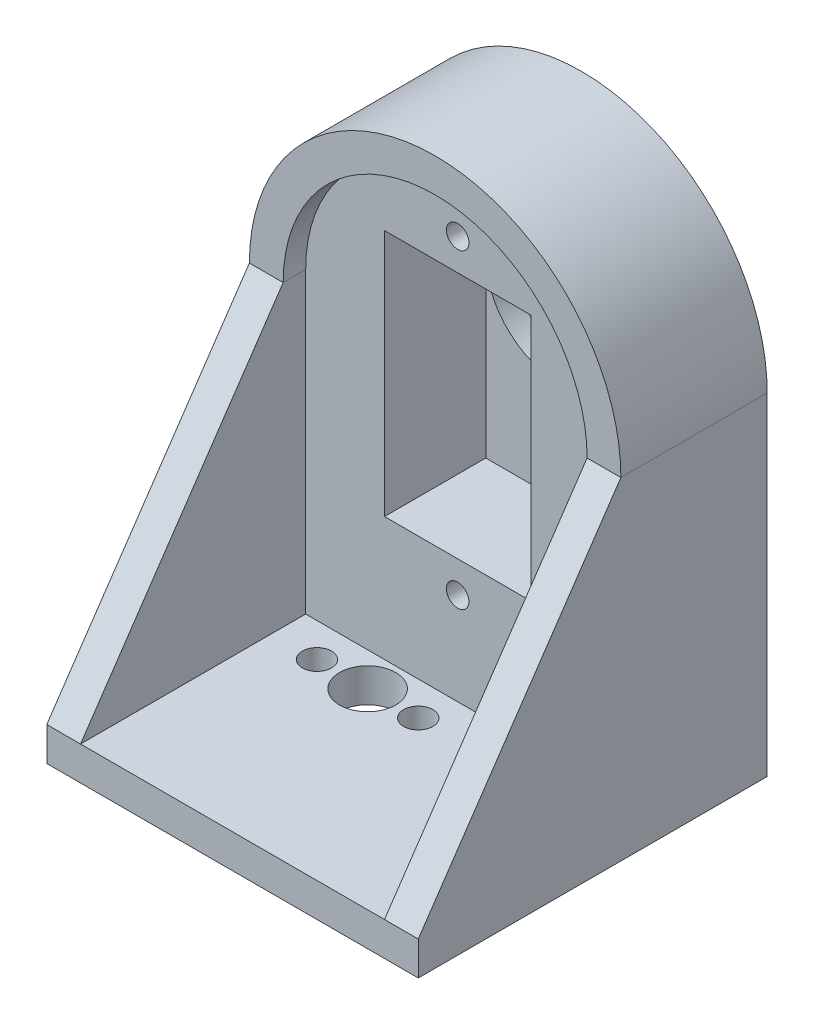
from build123d import *

# Parameters (mm, degrees)
SKETCH1_R           = 6.5
BOSS_EXTRUDE1_DEPTH = 13
CUT_EXTRUDE1_DEPTH  = 2
SKETCH3_R           = 1
SKETCH3_W           = 13
SKETCH3_H           = 22
CUT_EXTRUDE2_DEPTH  = 9
BOSS_EXTRUDE2_DEPTH = 18
BOSS_EXTRUDE3_DEPTH = 1.5
BOSS_EXTRUDE4_DEPTH = 1.5
SKETCH7_R           = 2.5
SKETCH7_R_2         = 1.3
CUT_EXTRUDE3_DEPTH  = 5


with BuildPart() as part:
    # Sketch1 → Boss-Extrude1 (new body)
    with BuildSketch(Plane.XY):
        with BuildLine():
            Line((-16.5, 0), (-16.5, -29.5))
            Line((-16.5, -29.5), (16.5, -29.5))
            Line((16.5, -29.5), (16.5, 0))
            ThreePointArc((16.5, 0), (0, 16.5), (-16.5, 0))
        make_face()
        with Locations(Location((0, 0, 0), (0, 0, 180))):
            Circle(SKETCH1_R, mode=Mode.SUBTRACT)
    extrude(amount=BOSS_EXTRUDE1_DEPTH)

    # Sketch2 → Cut-Extrude1 (cut)
    with BuildSketch(Plane.XY.offset(13)):
        with BuildLine():
            Line((-13.5, -26.5), (13.5, -26.5))
            Line((13.5, -26.5), (13.5, 0))
            ThreePointArc((13.5, 0), (0, 13.5), (-13.5, 0))
            Line((-13.5, 0), (-13.5, -26.5))
        make_face()
    extrude(amount=-CUT_EXTRUDE1_DEPTH, mode=Mode.SUBTRACT)

    # Sketch3 → Cut-Extrude2 (cut)
    with BuildSketch(Plane.XY.offset(11)):
        with Locations((0, 9.3)):
            Circle(SKETCH3_R)
        with Locations(Location((0, -18.3, 0), (0, 0, 180))):
            Circle(SKETCH3_R)
        with Locations((0, -4.5)):
            Rectangle(SKETCH3_W, SKETCH3_H)
    extrude(amount=-CUT_EXTRUDE2_DEPTH, mode=Mode.SUBTRACT)

    # Sketch4 → Boss-Extrude2 (add)
    with BuildSketch(Plane.XY.offset(13)):
        Polygon((-16.5, -26.5), (-16.5, -29.5), (16.5, -29.5), (16.5, -26.5), (13.5, -26.5), (-13.5, -26.5), align=None)
    extrude(amount=BOSS_EXTRUDE2_DEPTH)

    # Sketch5 → Boss-Extrude3 (add, symmetric)
    with BuildSketch(Plane(origin=(-15, 0, 0), x_dir=(0, 0, -1), z_dir=(1, 0, 0))):
        Polygon((-13, 0), (-31, -26.5), (-13, -26.5), align=None)
    extrude(amount=BOSS_EXTRUDE3_DEPTH, both=True)

    # Sketch6 → Boss-Extrude4 (add, symmetric)
    with BuildSketch(Plane(origin=(15, 0, 0), x_dir=(0, 0, -1), z_dir=(1, 0, 0))):
        Polygon((-13, 0), (-31, -26.5), (-13, -26.5), align=None)
    extrude(amount=BOSS_EXTRUDE4_DEPTH, both=True)

    # Sketch7 → Cut-Extrude3 (cut)
    with BuildSketch(Plane.XZ.offset(29.5)):
        with Locations(Location((-5, 14, 0), (0, 0, 270))):
            Circle(SKETCH7_R)
        with Locations(Location((-0.5, 14, 0), (0, 0, 270))):
            Circle(SKETCH7_R_2)
        with Locations(Location((-9.5, 14, 0), (0, 0, 270))):
            Circle(SKETCH7_R_2)
    extrude(amount=-CUT_EXTRUDE3_DEPTH, mode=Mode.SUBTRACT)


solid = part.part
